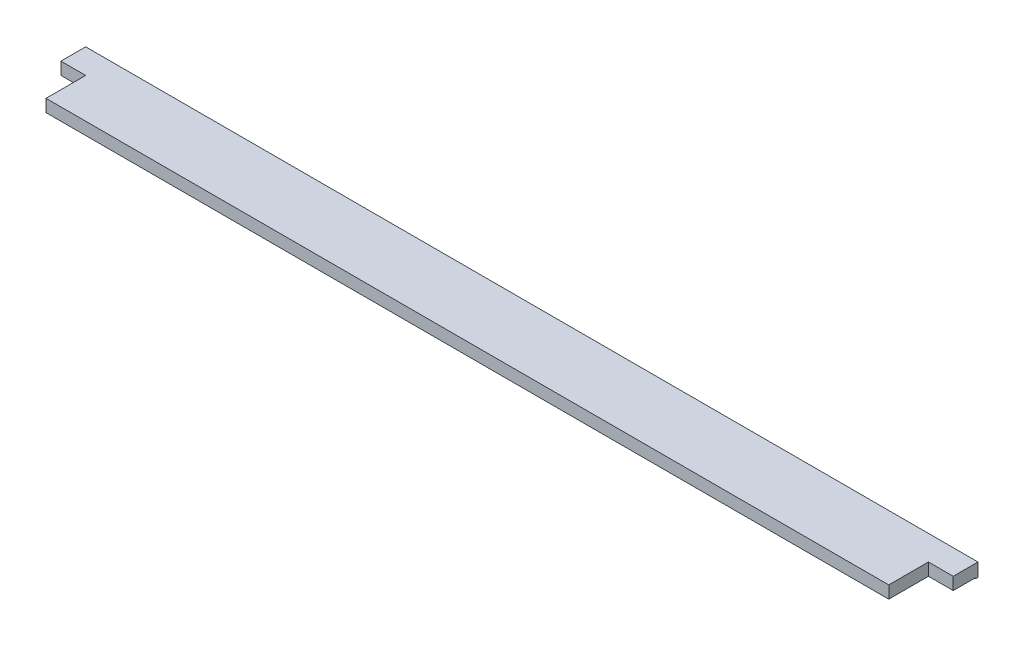
from build123d import *

# Parameters (mm, degrees)
EXTRUDE_1_DEPTH     = 1800
SKETCH_2_W          = 50
SKETCH_2_H          = 80
CUT_EXTRUDE_1_DEPTH = 1805.890301376


with BuildPart() as part:
    # Эскиз1 → Бобышка-Вытянуть1 (new body)
    with BuildSketch(Plane(origin=(0, 0, 0), x_dir=(0, 0, -1), z_dir=(1, 0, 0))):
        Polygon((0, 0), (130, 0), (130, -27), (125, -27), (125, -25), (0, -25), align=None)
    extrude(amount=EXTRUDE_1_DEPTH)

    # Эскиз2 → Вырез-Вытянуть1 (cut, through all)
    with BuildSketch(Plane(origin=(0, 0, 0), x_dir=(1, 0, 0), z_dir=(0, 1, 0))):
        with Locations((25, 40)):
            Rectangle(SKETCH_2_W, SKETCH_2_H)
        with Locations((1775, 40)):
            Rectangle(SKETCH_2_W, SKETCH_2_H)
    extrude(amount=-CUT_EXTRUDE_1_DEPTH, mode=Mode.SUBTRACT)


solid = part.part
